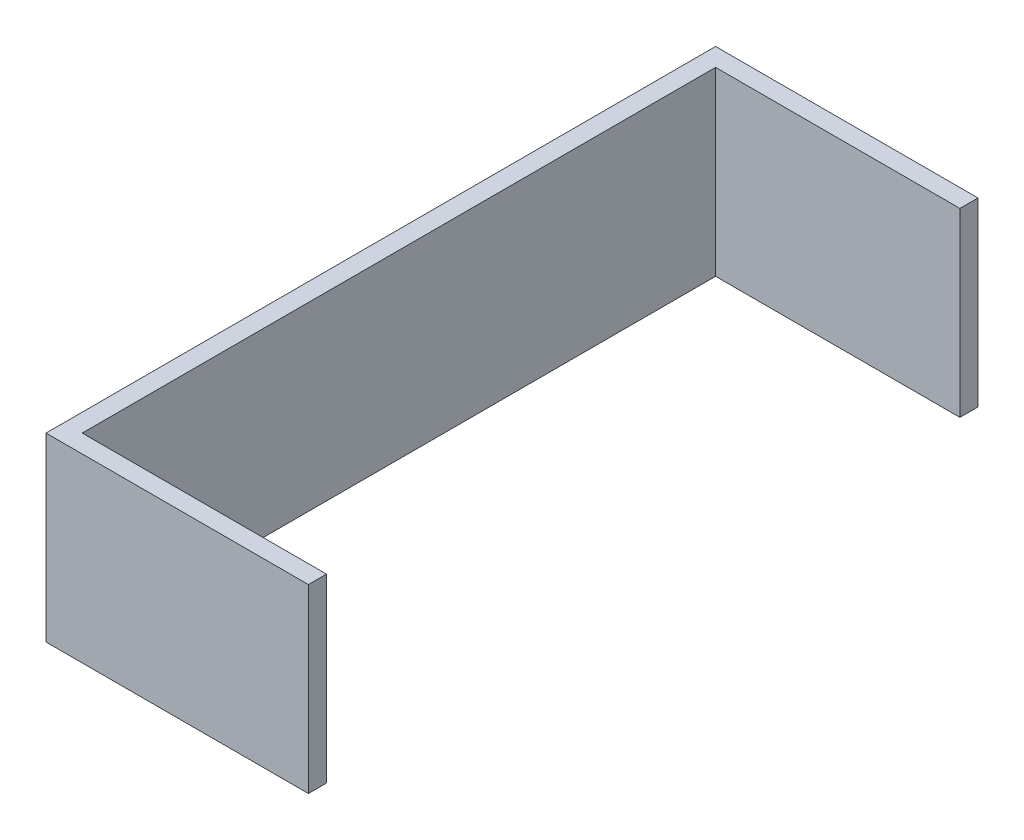
from build123d import *

# Parameters (mm, degrees)
BOSS_EXTRUDE1_DEPTH = 200


with BuildPart() as part:
    # Sketch3 → Boss-Extrude1 (new body)
    with BuildSketch(Plane(origin=(0, 0, 0), x_dir=(1, 0, 0), z_dir=(0, 1, 0))):
        Polygon((-145, 370), (145, 370), (145, 350), (125, 350), (-125, 350), (-125, -350), (125, -350), (145, -350), (145, -370), (-145, -370), align=None)
    extrude(amount=BOSS_EXTRUDE1_DEPTH)


solid = part.part
